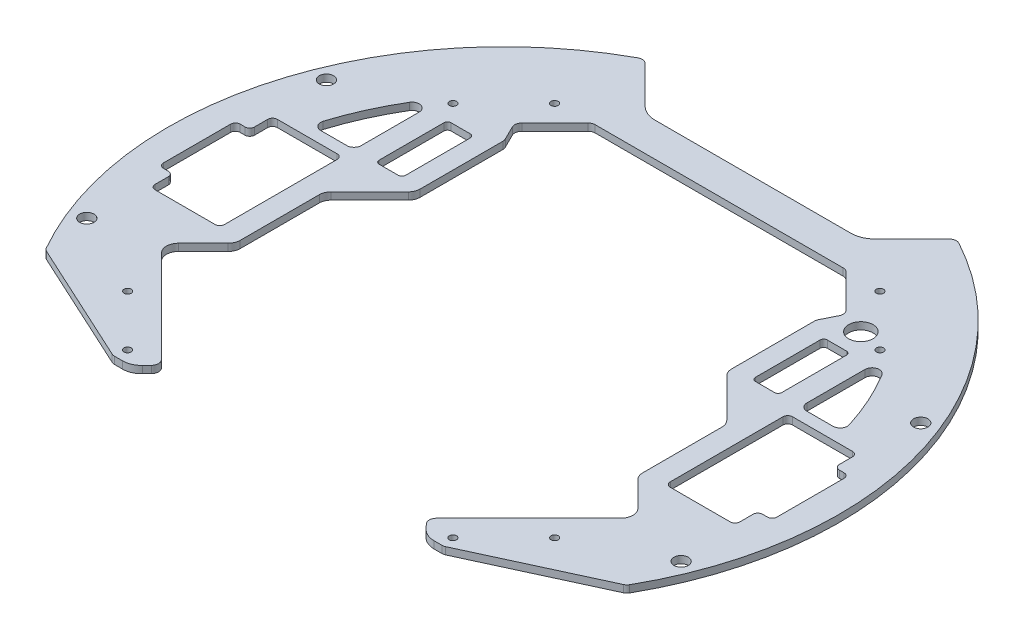
from build123d import *

# Parameters (mm, degrees)
SKETCH1_R            = 140
BOSS_EXTRUDE1_DEPTH  = 3
CUT_EXTRUDE3_REACH   = 200.013
SKETCH19_R           = 1.5
CUT_EXTRUDE1_REACH   = 200.013
CUT_EXTRUDE4_REACH   = 200.013
CUT_EXTRUDE5_REACH   = 189.04
FILLET1_R            = 20
FILLET2_R            = 10
CUT_EXTRUDE6_REACH   = 189.04
SKETCH22_W           = 29
SKETCH22_H           = 51
CUT_EXTRUDE15_REACH  = 189.04
SKETCH31_W           = 6
SKETCH31_H           = 32
FILLET3_R            = 2
CUT_EXTRUDE7_REACH   = 189.04
SKETCH23_R           = 3
CUT_EXTRUDE8_REACH   = 189.04
FILLET4_R            = 3
FILLET4_OF_MIRROR1_R = 3
CUT_EXTRUDE10_START  = -3
SKETCH26_W           = 130
SKETCH26_H           = 155.6711396
CUT_EXTRUDE10_DEPTH  = 3
CUT_EXTRUDE11_REACH  = 189.04
SKETCH27_W           = 105.933627874
SKETCH27_H           = 12.033186063
FILLET5_R            = 3
CUT_EXTRUDE16_REACH  = 188.58
SKETCH32_W           = 11
SKETCH32_H           = 30
FILLET7_R            = 1.5
FILLET7_OF_MIRROR2_R = 1.5
CUT_EXTRUDE13_REACH  = 188.58
SKETCH29_R           = 5.1
CUT_EXTRUDE17_REACH  = 188.58
FILLET8_R            = 5


with BuildPart() as part:
    # Sketch1 → Boss-Extrude1 (new body)
    with BuildSketch(Plane(origin=(0, 0, 0), x_dir=(1, 0, 0), z_dir=(0, 1, 0))):
        with Locations(Location((0, 0, 0), (0, 0, 270))):
            Circle(SKETCH1_R)
    extrude(amount=BOSS_EXTRUDE1_DEPTH)

    # Sketch19 → Cut-Extrude3 (cut, up to next)
    with BuildSketch(Plane(origin=(0, 3, 0), x_dir=(1, 0, 0), z_dir=(0, 1, 0)), mode=Mode.PRIVATE) as cut_extrude3_sk1:
        with Locations(Location((-89.09545443, -67.882250994, 0), (0, 0, 270))):
            Circle(SKETCH19_R)
    cut_extrude3_tool1 = extrude(cut_extrude3_sk1.sketch, amount=-CUT_EXTRUDE3_REACH, mode=Mode.PRIVATE) & part.part
    # Sketch19 → Cut-Extrude3 (cut, up to next)
    with BuildSketch(Plane(origin=(0, 3, 0), x_dir=(1, 0, 0), z_dir=(0, 1, 0)), mode=Mode.PRIVATE) as cut_extrude3_sk2:
        with Locations(Location((-89.09545443, 67.882250994, 0), (0, 0, 270))):
            Circle(SKETCH19_R)
    cut_extrude3_tool2 = extrude(cut_extrude3_sk2.sketch, amount=-CUT_EXTRUDE3_REACH, mode=Mode.PRIVATE) & part.part
    # Sketch19 → Cut-Extrude3 (cut, up to next)
    with BuildSketch(Plane(origin=(0, 3, 0), x_dir=(1, 0, 0), z_dir=(0, 1, 0)), mode=Mode.PRIVATE) as cut_extrude3_sk3:
        with Locations(Location((89.09545443, 67.882250994, 0), (0, 0, 270))):
            Circle(SKETCH19_R)
    cut_extrude3_tool3 = extrude(cut_extrude3_sk3.sketch, amount=-CUT_EXTRUDE3_REACH, mode=Mode.PRIVATE) & part.part
    # Sketch19 → Cut-Extrude3 (cut, up to next)
    with BuildSketch(Plane(origin=(0, 3, 0), x_dir=(1, 0, 0), z_dir=(0, 1, 0)), mode=Mode.PRIVATE) as cut_extrude3_sk4:
        with Locations(Location((89.09545443, -67.882250994, 0), (0, 0, 270))):
            Circle(SKETCH19_R)
    cut_extrude3_tool4 = extrude(cut_extrude3_sk4.sketch, amount=-CUT_EXTRUDE3_REACH, mode=Mode.PRIVATE) & part.part
    # Sketch19 → Cut-Extrude3 (cut, up to next)
    with BuildSketch(Plane(origin=(0, 3, 0), x_dir=(1, 0, 0), z_dir=(0, 1, 0)), mode=Mode.PRIVATE) as cut_extrude3_sk5:
        with Locations(Location((-67.882250994, -89.09545443, 0), (0, 0, 270))):
            Circle(SKETCH19_R)
    cut_extrude3_tool5 = extrude(cut_extrude3_sk5.sketch, amount=-CUT_EXTRUDE3_REACH, mode=Mode.PRIVATE) & part.part
    # Sketch19 → Cut-Extrude3 (cut, up to next)
    with BuildSketch(Plane(origin=(0, 3, 0), x_dir=(1, 0, 0), z_dir=(0, 1, 0)), mode=Mode.PRIVATE) as cut_extrude3_sk6:
        with Locations(Location((67.882250994, 89.09545443, 0), (0, 0, 270))):
            Circle(SKETCH19_R)
    cut_extrude3_tool6 = extrude(cut_extrude3_sk6.sketch, amount=-CUT_EXTRUDE3_REACH, mode=Mode.PRIVATE) & part.part
    # Sketch19 → Cut-Extrude3 (cut, up to next)
    with BuildSketch(Plane(origin=(0, 3, 0), x_dir=(1, 0, 0), z_dir=(0, 1, 0)), mode=Mode.PRIVATE) as cut_extrude3_sk7:
        with Locations(Location((-67.882250994, 89.09545443, 0), (0, 0, 270))):
            Circle(SKETCH19_R)
    cut_extrude3_tool7 = extrude(cut_extrude3_sk7.sketch, amount=-CUT_EXTRUDE3_REACH, mode=Mode.PRIVATE) & part.part
    # Sketch19 → Cut-Extrude3 (cut, up to next)
    with BuildSketch(Plane(origin=(0, 3, 0), x_dir=(1, 0, 0), z_dir=(0, 1, 0)), mode=Mode.PRIVATE) as cut_extrude3_sk8:
        with Locations(Location((67.882250994, -89.09545443, 0), (0, 0, 270))):
            Circle(SKETCH19_R)
    cut_extrude3_tool8 = extrude(cut_extrude3_sk8.sketch, amount=-CUT_EXTRUDE3_REACH, mode=Mode.PRIVATE) & part.part
    add(cut_extrude3_tool1.solids().sort_by_distance((-89.095454, 3, 67.882251))[0], mode=Mode.SUBTRACT)
    add(cut_extrude3_tool2.solids().sort_by_distance((-89.095454, 3, -67.882251))[0], mode=Mode.SUBTRACT)
    add(cut_extrude3_tool3.solids().sort_by_distance((89.095454, 3, -67.882251))[0], mode=Mode.SUBTRACT)
    add(cut_extrude3_tool4.solids().sort_by_distance((89.095454, 3, 67.882251))[0], mode=Mode.SUBTRACT)
    add(cut_extrude3_tool5.solids().sort_by_distance((-67.882251, 3, 89.095454))[0], mode=Mode.SUBTRACT)
    add(cut_extrude3_tool6.solids().sort_by_distance((67.882251, 3, -89.095454))[0], mode=Mode.SUBTRACT)
    add(cut_extrude3_tool7.solids().sort_by_distance((-67.882251, 3, -89.095454))[0], mode=Mode.SUBTRACT)
    add(cut_extrude3_tool8.solids().sort_by_distance((67.882251, 3, 89.095454))[0], mode=Mode.SUBTRACT)

    # Sketch17 → Cut-Extrude1 (cut, up to next)
    with BuildSketch(Plane.XZ, mode=Mode.PRIVATE) as cut_extrude1_sk1:
        Polygon((-68.979339991, 94.09545443), (-121.24355653, 70), (-121.24355653, 140), (121.24355653, 140), (121.24355653, 70), (68.979339991, 94.09545443), align=None)
    cut_extrude1_tool1 = extrude(cut_extrude1_sk1.sketch, amount=-CUT_EXTRUDE1_REACH, mode=Mode.PRIVATE) & part.part
    add(cut_extrude1_tool1.solids().sort_by_distance((0, 0, 113.898628))[0], mode=Mode.SUBTRACT)

    # Sketch20 → Cut-Extrude4 (cut, up to next)
    with BuildSketch(Plane(origin=(0, 3, 0), x_dir=(1, 0, 0), z_dir=(0, 1, 0)), mode=Mode.PRIVATE) as cut_extrude4_sk1:
        Polygon((-495.364980823, 554.360948499), (-65, 123.995967676), (-45, 103.995967676), (45, 103.995967676), (65, 123.995967676), (495.364980823, 554.360948499), (495.364980823, 1771.6169338), (-495.364980823, 1771.6169338), align=None)
    cut_extrude4_tool1 = extrude(cut_extrude4_sk1.sketch, amount=-CUT_EXTRUDE4_REACH, mode=Mode.PRIVATE) & part.part
    add(cut_extrude4_tool1.solids().sort_by_distance((0, 3, -1033.48606))[0], mode=Mode.SUBTRACT)

    # Sketch21 → Cut-Extrude5 (cut, up to next)
    with BuildSketch(Plane(origin=(0, 3, 0), x_dir=(1, 0, 0), z_dir=(0, 1, 0)), mode=Mode.PRIVATE) as cut_extrude5_sk1:
        with BuildLine():
            Line((-52.966813937, 89.868755863), (0, 60))
            Line((0, 60), (52.966813937, 89.868755863))
            Line((52.966813937, 89.868755863), (69.155825469, 73.679744331))
            Line((69.155825469, 73.679744331), (40, 15))
            Line((40, 15), (70.501942073, -72.333627726))
            Line((70.501942073, -72.333627726), (55.294049228, -87.541520571))
            Line((55.294049228, -87.541520571), (59.231041795, -91.638535384))
            ThreePointArc((59.231041795, -91.638535384), (61.864513289, -93.455639469), (64.999425757, -94.09545443))
            Line((64.999425757, -94.09545443), (-64.999425757, -94.09545443))
            ThreePointArc((-64.999425757, -94.09545443), (-61.864513289, -93.455639469), (-59.231041795, -91.638535384))
            Line((-59.231041795, -91.638535384), (-55.294049228, -87.541520571))
            Line((-55.294049228, -87.541520571), (-70.501942073, -72.333627726))
            Line((-70.501942073, -72.333627726), (-40, 15))
            Line((-40, 15), (-69.155825469, 73.679744331))
            Line((-69.155825469, 73.679744331), (-52.966813937, 89.868755863))
        make_face()
    cut_extrude5_tool1 = extrude(cut_extrude5_sk1.sketch, amount=-CUT_EXTRUDE5_REACH, mode=Mode.PRIVATE) & part.part
    add(cut_extrude5_tool1.solids().sort_by_distance((0, 3, 10.577825))[0], mode=Mode.SUBTRACT)

    # Fillet1
    fillet1_edges = [part.edges().sort_by_distance(p)[0] for p in [
        (-40, 1.5, -15),
        (0, 1.5, -60),
        (40, 1.5, -15),
    ]]
    fillet(fillet1_edges, radius=FILLET1_R)

    # Fillet2
    fillet2_edges = [part.edges().sort_by_distance(p)[0] for p in [
        (45, 1.5, -103.995967676),
        (-45, 1.5, -103.995967676),
    ]]
    fillet(fillet2_edges, radius=FILLET2_R)

    # Sketch22 → Cut-Extrude6 (cut, up to next)
    with BuildSketch(Plane(origin=(0, 3, 0), x_dir=(1, 0, 0), z_dir=(0, 1, 0)), mode=Mode.PRIVATE) as cut_extrude6_sk1:
        with Locations((107.5, 0)):
            Rectangle(SKETCH22_W, SKETCH22_H)
    cut_extrude6_tool1 = extrude(cut_extrude6_sk1.sketch, amount=-CUT_EXTRUDE6_REACH, mode=Mode.PRIVATE) & part.part
    # Sketch22 → Cut-Extrude6 (cut, up to next)
    with BuildSketch(Plane(origin=(0, 3, 0), x_dir=(1, 0, 0), z_dir=(0, 1, 0)), mode=Mode.PRIVATE) as cut_extrude6_sk2:
        with Locations((-107.5, 0)):
            Rectangle(SKETCH22_W, SKETCH22_H)
    cut_extrude6_tool2 = extrude(cut_extrude6_sk2.sketch, amount=-CUT_EXTRUDE6_REACH, mode=Mode.PRIVATE) & part.part
    add(cut_extrude6_tool1.solids().sort_by_distance((107.5, 3, 0))[0], mode=Mode.SUBTRACT)
    add(cut_extrude6_tool2.solids().sort_by_distance((-107.5, 3, 0))[0], mode=Mode.SUBTRACT)

    # Sketch31 → Cut-Extrude15 (cut, up to next)
    with BuildSketch(Plane(origin=(0, 3, 0), x_dir=(1, 0, 0), z_dir=(0, 1, 0)), mode=Mode.PRIVATE) as cut_extrude15_sk1:
        with Locations((-125, 0)):
            Rectangle(SKETCH31_W, SKETCH31_H)
    cut_extrude15_tool1 = extrude(cut_extrude15_sk1.sketch, amount=-CUT_EXTRUDE15_REACH, mode=Mode.PRIVATE) & part.part
    # Sketch31 → Cut-Extrude15 (cut, up to next)
    with BuildSketch(Plane(origin=(0, 3, 0), x_dir=(1, 0, 0), z_dir=(0, 1, 0)), mode=Mode.PRIVATE) as cut_extrude15_sk2:
        with Locations((125, 0)):
            Rectangle(SKETCH31_W, SKETCH31_H)
    cut_extrude15_tool2 = extrude(cut_extrude15_sk2.sketch, amount=-CUT_EXTRUDE15_REACH, mode=Mode.PRIVATE) & part.part
    add(cut_extrude15_tool1.solids().sort_by_distance((-125, 3, 0))[0], mode=Mode.SUBTRACT)
    add(cut_extrude15_tool2.solids().sort_by_distance((125, 3, 0))[0], mode=Mode.SUBTRACT)

    # Fillet3
    fillet3_edges = [part.edges().sort_by_distance(p)[0] for p in [
        (93, 1.5, 25.5),
        (93, 1.5, -25.5),
        (122, 1.5, -25.5),
        (122, 1.5, 25.5),
        (-122, 1.5, 25.5),
        (-122, 1.5, -25.5),
        (-93, 1.5, -25.5),
        (-93, 1.5, 25.5),
        (-128, 1.5, 16),
        (-128, 1.5, -16),
        (-122, 1.5, -16),
        (-122, 1.5, 16),
        (128, 1.5, -16),
        (128, 1.5, 16),
        (122, 1.5, 16),
        (122, 1.5, -16),
    ]]
    fillet(fillet3_edges, radius=FILLET3_R)

    # Sketch23 → Cut-Extrude7 (cut, up to next)
    with BuildSketch(Plane(origin=(0, 3, 0), x_dir=(1, 0, 0), z_dir=(0, 1, 0)), mode=Mode.PRIVATE) as cut_extrude7_sk1:
        with Locations(Location((-124, 50, 0), (0, 0, 270))):
            Circle(SKETCH23_R)
    cut_extrude7_tool1 = extrude(cut_extrude7_sk1.sketch, amount=-CUT_EXTRUDE7_REACH, mode=Mode.PRIVATE) & part.part
    # Sketch23 → Cut-Extrude7 (cut, up to next)
    with BuildSketch(Plane(origin=(0, 3, 0), x_dir=(1, 0, 0), z_dir=(0, 1, 0)), mode=Mode.PRIVATE) as cut_extrude7_sk2:
        with Locations(Location((-124, -50, 0), (0, 0, 270))):
            Circle(SKETCH23_R)
    cut_extrude7_tool2 = extrude(cut_extrude7_sk2.sketch, amount=-CUT_EXTRUDE7_REACH, mode=Mode.PRIVATE) & part.part
    # Sketch23 → Cut-Extrude7 (cut, up to next)
    with BuildSketch(Plane(origin=(0, 3, 0), x_dir=(1, 0, 0), z_dir=(0, 1, 0)), mode=Mode.PRIVATE) as cut_extrude7_sk3:
        with Locations(Location((124, -50, 0), (0, 0, 270))):
            Circle(SKETCH23_R)
    cut_extrude7_tool3 = extrude(cut_extrude7_sk3.sketch, amount=-CUT_EXTRUDE7_REACH, mode=Mode.PRIVATE) & part.part
    # Sketch23 → Cut-Extrude7 (cut, up to next)
    with BuildSketch(Plane(origin=(0, 3, 0), x_dir=(1, 0, 0), z_dir=(0, 1, 0)), mode=Mode.PRIVATE) as cut_extrude7_sk4:
        with Locations(Location((124, 50, 0), (0, 0, 270))):
            Circle(SKETCH23_R)
    cut_extrude7_tool4 = extrude(cut_extrude7_sk4.sketch, amount=-CUT_EXTRUDE7_REACH, mode=Mode.PRIVATE) & part.part
    add(cut_extrude7_tool1.solids().sort_by_distance((-124, 3, -50))[0], mode=Mode.SUBTRACT)
    add(cut_extrude7_tool2.solids().sort_by_distance((-124, 3, 50))[0], mode=Mode.SUBTRACT)
    add(cut_extrude7_tool3.solids().sort_by_distance((124, 3, 50))[0], mode=Mode.SUBTRACT)
    add(cut_extrude7_tool4.solids().sort_by_distance((124, 3, -50))[0], mode=Mode.SUBTRACT)

    # Sketch24 → Cut-Extrude8 (cut, up to next)
    with BuildSketch(Plane(origin=(0, 3, 0), x_dir=(1, 0, 0), z_dir=(0, 1, 0)), mode=Mode.PRIVATE) as cut_extrude8_sk1:
        with BuildLine():
            Line((-93, 57.688820407), (-93, 30.5))
            Line((-93, 30.5), (-110.88169371, 30.5))
            ThreePointArc((-110.88169371, 30.5), (-105.707445866, 45.287259671), (-98.571428571, 59.234056668))
            ThreePointArc((-98.571428571, 59.234056668), (-95.198216274, 60.579692742), (-93, 57.688820407))
        make_face()
    cut_extrude8_tool1 = extrude(cut_extrude8_sk1.sketch, amount=-CUT_EXTRUDE8_REACH, mode=Mode.PRIVATE) & part.part
    cut_extrude8 = cut_extrude8_tool1.solids().sort_by_distance((-99.705341, 3, -42.761478))[0]
    add(cut_extrude8, mode=Mode.SUBTRACT)

    # Fillet4
    fillet4_edges = [part.edges().sort_by_distance(p)[0] for p in [
        (-110.88169371, 1.5, -30.5),
        (-93, 1.5, -30.5),
    ]]
    fillet(fillet4_edges, radius=FILLET4_R)

    # Mirror1: Cut-Extrude8 across plane
    add(cut_extrude8.mirror(Plane(origin=(0, 0, 0), x_dir=(0, 0, 1), z_dir=(1, 0, 0))), mode=Mode.SUBTRACT)

    # Fillet4 of Mirror1
    fillet4_of_mirror1_edges = [part.edges().sort_by_distance(p)[0] for p in [
        (110.88169371, 1.5, -30.5),
        (93, 1.5, -30.5),
    ]]
    fillet(fillet4_of_mirror1_edges, radius=FILLET4_OF_MIRROR1_R)

    # Sketch26 → Cut-Extrude10 (cut)
    with BuildSketch(Plane(origin=(0, 3, 0), x_dir=(1, 0, 0), z_dir=(0, 1, 0)).offset(CUT_EXTRUDE10_START)):
        Rectangle(SKETCH26_W, SKETCH26_H)
    extrude(amount=CUT_EXTRUDE10_DEPTH, mode=Mode.SUBTRACT)

    # Sketch27 → Cut-Extrude11 (cut, up to next)
    with BuildSketch(Plane(origin=(0, 3, 0), x_dir=(1, 0, 0), z_dir=(0, 1, 0)), mode=Mode.PRIVATE) as cut_extrude11_sk1:
        with Locations((0, 83.852162832)):
            Rectangle(SKETCH27_W, SKETCH27_H)
    cut_extrude11_tool1 = extrude(cut_extrude11_sk1.sketch, amount=-CUT_EXTRUDE11_REACH, mode=Mode.PRIVATE) & part.part
    add(cut_extrude11_tool1.solids().sort_by_distance((0, 3, -83.852163))[0], mode=Mode.SUBTRACT)

    # Fillet5
    fillet5_edges = [part.edges().sort_by_distance(p)[0] for p in [
        (-65, 1.5, -65.31562594),
        (-65, 1.5, 56.580382912),
        (65, 1.5, -65.31562594),
        (65, 1.5, 56.580382912),
        (68.979339991, 1.5, 94.09545443),
        (-68.979339991, 1.5, 94.09545443),
        (121.24355653, 1.5, 70),
        (-121.24355653, 1.5, 70),
        (65, 1.5, -123.995967676),
        (-65, 1.5, -123.995967676),
        (-55.294049228, 1.5, 87.541520571),
        (-70.501942073, 1.5, 72.333627726),
        (-69.155825469, 1.5, -73.679744331),
        (-52.966813937, 1.5, -89.868755863),
        (52.966813937, 1.5, -89.868755863),
        (69.155825469, 1.5, -73.679744331),
        (70.501942073, 1.5, 72.333627726),
        (55.294049228, 1.5, 87.541520571),
    ]]
    fillet(fillet5_edges, radius=FILLET5_R)

    # Sketch32 → Cut-Extrude16 (cut, up to next)
    with BuildSketch(Plane(origin=(0, 3, 0), x_dir=(1, 0, 0), z_dir=(0, 1, 0)), mode=Mode.PRIVATE) as cut_extrude16_sk1:
        with Locations((-78.5, 45.5)):
            Rectangle(SKETCH32_W, SKETCH32_H)
    cut_extrude16_tool1 = extrude(cut_extrude16_sk1.sketch, amount=-CUT_EXTRUDE16_REACH, mode=Mode.PRIVATE) & part.part
    cut_extrude16 = cut_extrude16_tool1.solids().sort_by_distance((-78.5, 3, -45.5))[0]
    add(cut_extrude16, mode=Mode.SUBTRACT)

    # Fillet7
    fillet7_edges = [part.edges().sort_by_distance(p)[0] for p in [
        (-84, 1.5, -30.5),
        (-84, 1.5, -60.5),
        (-73, 1.5, -60.5),
        (-73, 1.5, -30.5),
    ]]
    fillet(fillet7_edges, radius=FILLET7_R)

    # Mirror2: Cut-Extrude16 across plane
    add(cut_extrude16.mirror(Plane(origin=(0, 0, 0), x_dir=(0, 0, 1), z_dir=(1, 0, 0))), mode=Mode.SUBTRACT)

    # Fillet7 of Mirror2
    fillet7_of_mirror2_edges = [part.edges().sort_by_distance(p)[0] for p in [
        (84, 1.5, -30.5),
        (84, 1.5, -60.5),
        (73, 1.5, -60.5),
        (73, 1.5, -30.5),
    ]]
    fillet(fillet7_of_mirror2_edges, radius=FILLET7_OF_MIRROR2_R)

    # Sketch29 → Cut-Extrude13 (cut, up to next)
    with BuildSketch(Plane(origin=(0, 3, 0), x_dir=(1, 0, 0), z_dir=(0, 1, 0)), mode=Mode.PRIVATE) as cut_extrude13_sk1:
        with Locations(Location((78.5, 70.5, 0), (0, 0, 270))):
            Circle(SKETCH29_R)
    cut_extrude13_tool1 = extrude(cut_extrude13_sk1.sketch, amount=-CUT_EXTRUDE13_REACH, mode=Mode.PRIVATE) & part.part
    add(cut_extrude13_tool1.solids().sort_by_distance((78.5, 3, -70.5))[0], mode=Mode.SUBTRACT)

    # Sketch34 → Cut-Extrude17 (cut, up to next)
    with BuildSketch(Plane(origin=(0, 3, 0), x_dir=(1, 0, 0), z_dir=(0, 1, 0)), mode=Mode.PRIVATE) as cut_extrude17_sk1:
        Polygon((-65, 28.064971157), (-84, 9.064971157), (-84, -28.056349186), (-99.389610307, -43.445959493), (-65, -77.8355698), align=None)
    cut_extrude17_tool1 = extrude(cut_extrude17_sk1.sketch, amount=-CUT_EXTRUDE17_REACH, mode=Mode.PRIVATE) & part.part
    cut_extrude17 = cut_extrude17_tool1.solids().sort_by_distance((-75.729785, 3, 27.213702))[0]
    add(cut_extrude17, mode=Mode.SUBTRACT)

    # Mirror3: Cut-Extrude17 across plane
    add(cut_extrude17.mirror(Plane(origin=(0, 0, 0), x_dir=(0, 0, 1), z_dir=(1, 0, 0))), mode=Mode.SUBTRACT)

    # Fillet8
    fillet8_edges = [part.edges().sort_by_distance(p)[0] for p in [
        (-65, 1.5, -28.064971157),
        (-99.389610307, 1.5, 43.445959493),
        (-84, 1.5, 28.056349186),
        (-84, 1.5, -9.064971157),
        (65, 1.5, -28.064971157),
        (84, 1.5, -9.064971157),
        (84, 1.5, 28.056349186),
        (99.389610307, 1.5, 43.445959493),
    ]]
    fillet(fillet8_edges, radius=FILLET8_R)


solid = part.part
